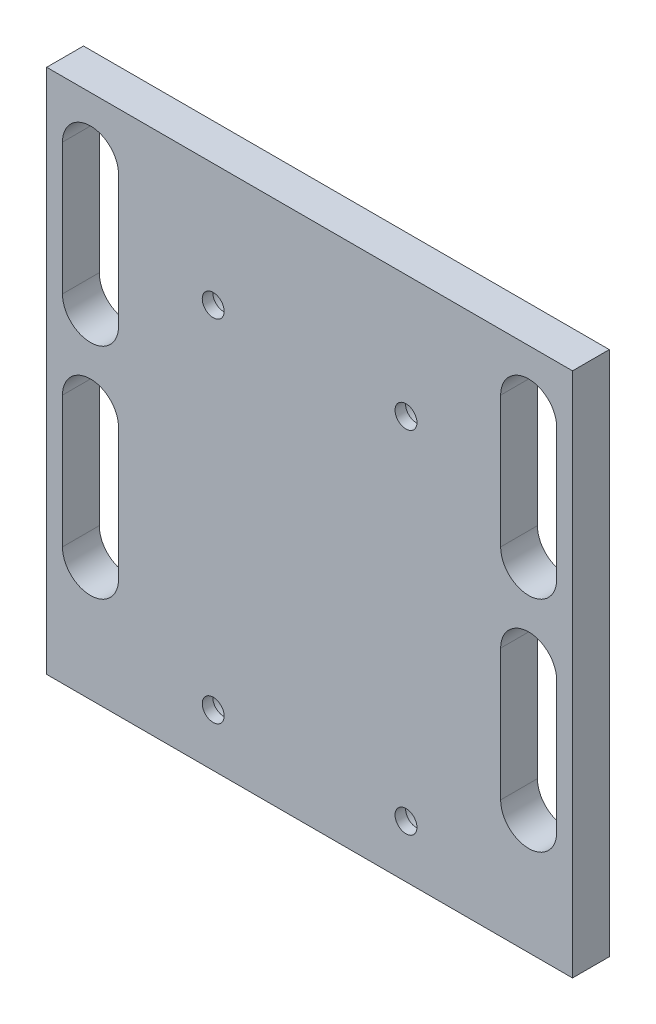
from build123d import *

# Parameters (mm, degrees)
SKETCH_1_W          = 60
SKETCH_1_H          = 60
SKETCH_1_R          = 1.25
EXTRUDE_1_DEPTH     = 4.2
SKETCH_3_R          = 2.5
CUT_EXTRUDE_2_DEPTH = 3


with BuildPart() as part:
    # 스케치1 → 보스-돌출1 (new body)
    with BuildSketch(Plane.XY):
        with Locations((0, 4)):
            Rectangle(SKETCH_1_W, SKETCH_1_H)
        with Locations((-11, 20)):
            Circle(SKETCH_1_R, mode=Mode.SUBTRACT)
        with Locations(Location((-11, -20, 0), (0, 0, 180))):
            Circle(SKETCH_1_R, mode=Mode.SUBTRACT)
        with Locations((11, -20)):
            Circle(SKETCH_1_R, mode=Mode.SUBTRACT)
        with Locations(Location((11, 20, 0), (0, 0, 180))):
            Circle(SKETCH_1_R, mode=Mode.SUBTRACT)
        with BuildLine():
            Line((-28.2, 27.5), (-28.2, 12.5))
            ThreePointArc((-28.2, 12.5), (-25, 9.3), (-21.8, 12.5))
            Line((-21.8, 12.5), (-21.8, 27.5))
            ThreePointArc((-21.8, 27.5), (-25, 30.7), (-28.2, 27.5))
        make_face(mode=Mode.SUBTRACT)
        with BuildLine():
            Line((-28.2, 2.5), (-28.2, -12.5))
            ThreePointArc((-28.2, -12.5), (-25, -15.7), (-21.8, -12.5))
            Line((-21.8, -12.5), (-21.8, 2.5))
            ThreePointArc((-21.8, 2.5), (-25, 5.7), (-28.2, 2.5))
        make_face(mode=Mode.SUBTRACT)
        with BuildLine():
            Line((21.8, 27.5), (21.8, 12.5))
            ThreePointArc((21.8, 12.5), (25, 9.3), (28.2, 12.5))
            Line((28.2, 12.5), (28.2, 27.5))
            ThreePointArc((28.2, 27.5), (25, 30.7), (21.8, 27.5))
        make_face(mode=Mode.SUBTRACT)
        with BuildLine():
            Line((21.8, 2.5), (21.8, -12.5))
            ThreePointArc((21.8, -12.5), (25, -15.7), (28.2, -12.5))
            Line((28.2, -12.5), (28.2, 2.5))
            ThreePointArc((28.2, 2.5), (25, 5.7), (21.8, 2.5))
        make_face(mode=Mode.SUBTRACT)
    extrude(amount=EXTRUDE_1_DEPTH)

    # 스케치3 → 컷-돌출2 (cut)
    with BuildSketch(Plane(origin=(0, 0, 0), x_dir=(-1, 0, 0), z_dir=(0, 0, -1))):
        with Locations((-11, 20)):
            Circle(SKETCH_3_R)
        with Locations((11, 20)):
            Circle(SKETCH_3_R)
        with Locations((-11, -20)):
            Circle(SKETCH_3_R)
        with Locations((11, -20)):
            Circle(SKETCH_3_R)
    extrude(amount=-CUT_EXTRUDE_2_DEPTH, mode=Mode.SUBTRACT)


solid = part.part
